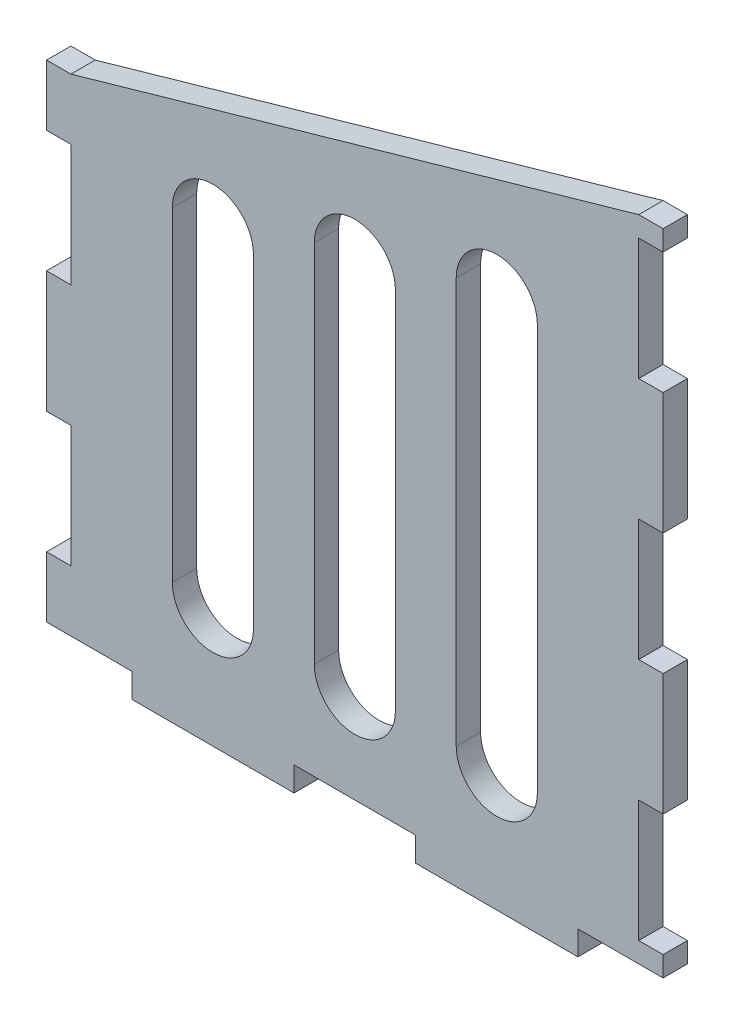
from build123d import *

# Parameters (mm, degrees)
SKETCH1_W           = 20
SKETCH1_H           = 3
BOSS_EXTRUDE1_DEPTH = 3


with BuildPart() as part:
    # Sketch1 → Boss-Extrude1 (new body)
    # profile 1 of 3: a face of its own
    with BuildSketch(Plane.XY):
        Polygon((35, 40), (-35, 20), (-38, 20), (-38, 12.5), (-35, 12.5), (-35, -2.5), (-38, -2.5), (-38, -17.5), (-35, -17.5), (-35, -32.5), (-38, -32.5), (-38, -40), (-27.5, -40), (-7.5, -40), (7.5, -40), (27.5, -40), (38, -40), (38, -37.5), (35, -37.5), (35, -22.5), (38, -22.5), (38, -7.5), (35, -7.5), (35, 7.5), (38, 7.5), (38, 22.5), (35, 22.5), (35, 37.5), (38, 37.5), (38, 40), align=None)
        with BuildLine():
            ThreePointArc((-12.5, -28), (-17.5, -33), (-22.5, -28))
            Line((-22.5, -28), (-22.5, 12))
            ThreePointArc((-22.5, 12), (-17.5, 17), (-12.5, 12))
            Line((-12.5, 12), (-12.5, -28))
        make_face(mode=Mode.SUBTRACT)
        with BuildLine():
            ThreePointArc((-5, 17), (0, 22), (5, 17))
            Line((5, 17), (5, -28))
            ThreePointArc((5, -28), (0, -33), (-5, -28))
            Line((-5, -28), (-5, 17))
        make_face(mode=Mode.SUBTRACT)
        with BuildLine():
            ThreePointArc((22.5, -28), (17.5, -33), (12.5, -28))
            Line((12.5, -28), (12.5, 22))
            ThreePointArc((12.5, 22), (17.5, 27), (22.5, 22))
            Line((22.5, 22), (22.5, -28))
        make_face(mode=Mode.SUBTRACT)
    # profile 2 of 3: a face of its own
    with BuildSketch(Plane.XY):
        with Locations((17.5, -41.5)):
            Rectangle(SKETCH1_W, SKETCH1_H)
    # profile 3 of 3: a face of its own
    with BuildSketch(Plane.XY):
        with Locations((-17.5, -41.5)):
            Rectangle(SKETCH1_W, SKETCH1_H)
    extrude(amount=BOSS_EXTRUDE1_DEPTH)


solid = part.part
